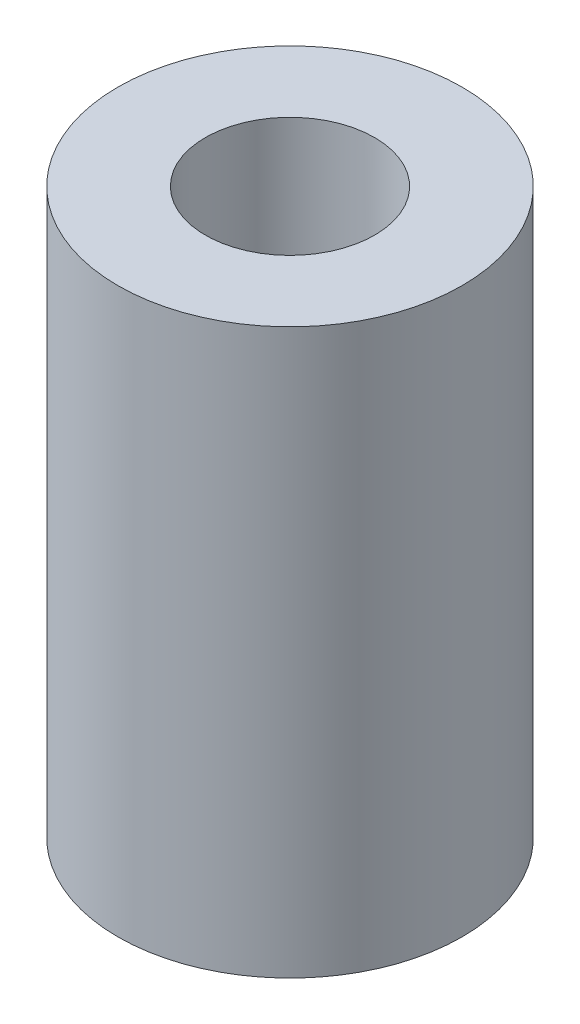
from build123d import *

# Parameters (mm, degrees)
CROQUIS1_R                            = 6.1
SALIENTE_EXTRUIR1_DEPTH               = 20
CROQUIS3_R                            = 3
CORTAR_EXTRUIR1_DEPTH                 = 22.781184541
CROQUIS5_W                            = 1.3
CROQUIS5_H                            = 6.1
TALADRO_DE_MARGEN_PARA_M21_AT_2_COUNT = 2
TALADRO_DE_MARGEN_PARA_M21_AT_2_PITCH = 10


with BuildPart() as part:
    # Croquis1 → Saliente-Extruir1 (new body)
    with BuildSketch(Plane(origin=(0, 0, 0), x_dir=(-1, 0, 0), z_dir=(0, 1, 0))):
        with Locations(Location((0, 0, 0), (0, 0, 90))):
            Circle(CROQUIS1_R)
    extrude(amount=SALIENTE_EXTRUIR1_DEPTH)

    # Croquis3 → Cortar-Extruir1 (cut, through all)
    with BuildSketch(Plane.XZ):
        with Locations(Location((0, 0, 0), (0, 0, 270))):
            Circle(CROQUIS3_R)
    extrude(amount=-CORTAR_EXTRUIR1_DEPTH, mode=Mode.SUBTRACT)

    # Croquis5 → Taladro de margen para M21 (revolve, cut)
    with BuildSketch(Plane(origin=(0, 15, 0), x_dir=(0, -1, 0), z_dir=(1, 0, 0))):
        with Locations((0.65, 3.05)):
            Rectangle(CROQUIS5_W, CROQUIS5_H)
    taladro_de_margen_para_m21 = revolve(axis=Axis((0, 15, 6.35), (0, 0, -1)), mode=Mode.SUBTRACT)

    # Taladro de margen para M21 at 2: Taladro de margen para M21 ×2
    with Locations(*[(0, -i * TALADRO_DE_MARGEN_PARA_M21_AT_2_PITCH, 0) for i in range(1, TALADRO_DE_MARGEN_PARA_M21_AT_2_COUNT)]):
        add(taladro_de_margen_para_m21, mode=Mode.SUBTRACT)


solid = part.part
